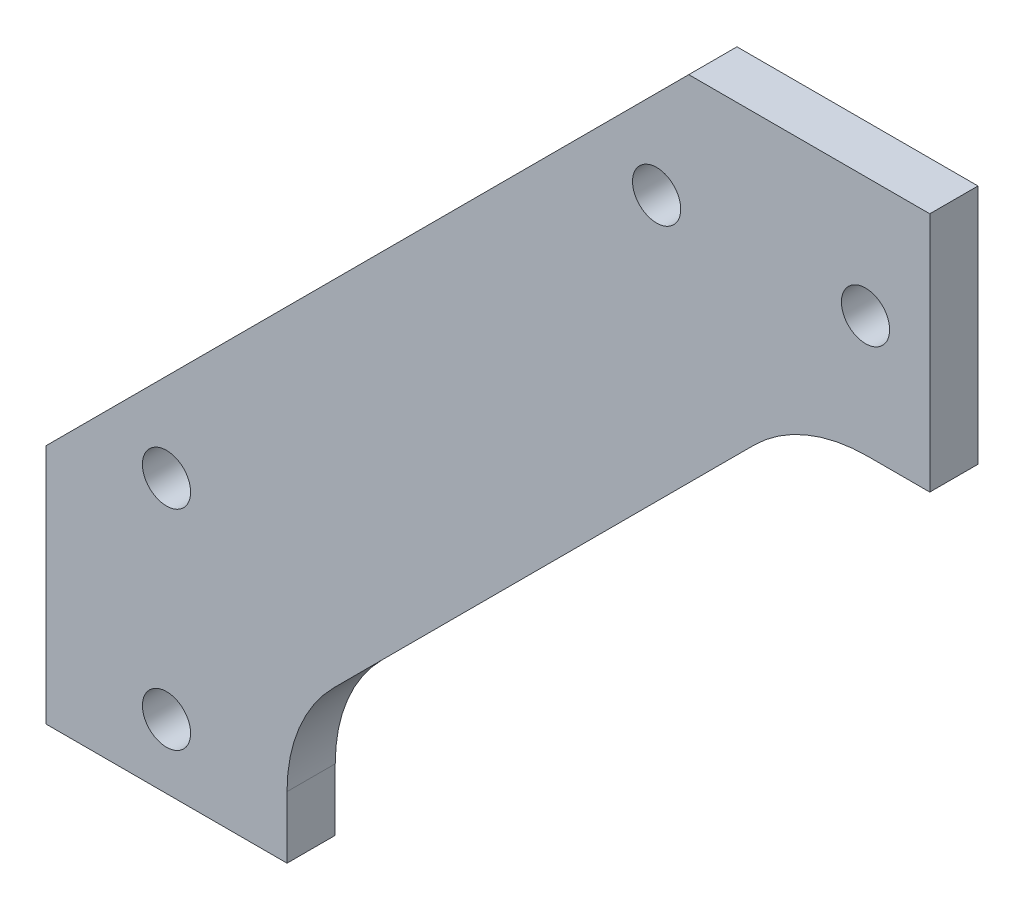
from build123d import *

# Parameters (mm, degrees)
EXTRUDE_1_DEPTH     = 3
SKETCH_2_R          = 1.5
CUT_EXTRUDE_1_DEPTH = 3


with BuildPart() as part:
    # 草图1 → 凸台-拉伸1 (new body)
    with BuildSketch(Plane.XY):
        with BuildLine():
            Line((0, 0), (15, 0))
            Line((15, 0), (15, -15))
            Line((15, -15), (11.142135624, -15))
            ThreePointArc((11.142135624, -15), (7.3153013, -15.761204675), (4.071067812, -17.928932188))
            Line((4.071067812, -17.928932188), (-22.071067812, -44.071067812))
            ThreePointArc((-22.071067812, -44.071067812), (-24.238795325, -47.3153013), (-25, -51.142135624))
            Line((-25, -51.142135624), (-25, -55))
            Line((-25, -55), (-40, -55))
            Line((-40, -55), (-40, -40))
            Line((-40, -40), (0, 0))
        make_face()
    extrude(amount=EXTRUDE_1_DEPTH)

    # 草图2 → 切除-拉伸1 (cut)
    with BuildSketch(Plane.XY.offset(3)):
        with Locations((11, -7.5)):
            Circle(SKETCH_2_R)
        with Locations((-2, -7.5)):
            Circle(SKETCH_2_R)
        with Locations((-32.5, -51)):
            Circle(SKETCH_2_R)
        with Locations((-32.5, -38)):
            Circle(SKETCH_2_R)
    extrude(amount=-CUT_EXTRUDE_1_DEPTH, mode=Mode.SUBTRACT)


solid = part.part
